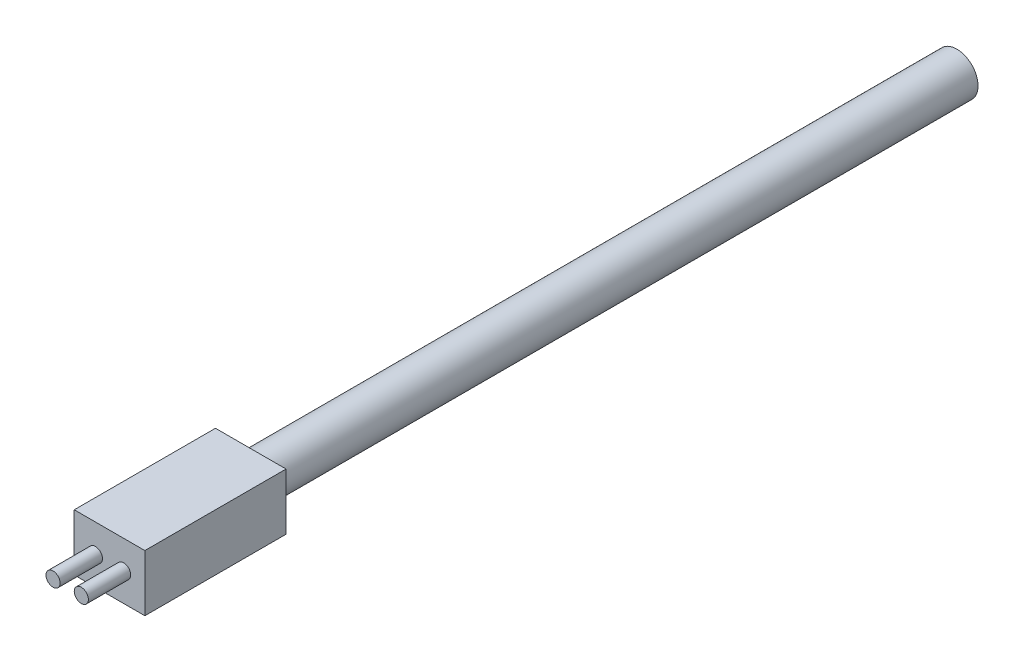
from build123d import *

# Parameters (mm, degrees)
SKETCH2_W           = 5
SKETCH2_H           = 10
BOSS_EXTRUDE1_DEPTH = 4
SKETCH4_R           = 0.5
BOSS_EXTRUDE2_DEPTH = 3
SKETCH5_R           = 1.5
BOSS_EXTRUDE3_DEPTH = 50


with BuildPart() as part:
    # Sketch2 → Boss-Extrude1 (new body)
    with BuildSketch(Plane(origin=(0, 0, 0), x_dir=(1, 0, 0), z_dir=(0, 1, 0))):
        Rectangle(SKETCH2_W, SKETCH2_H)
    extrude(amount=BOSS_EXTRUDE1_DEPTH)

    # Sketch4 → Boss-Extrude2 (add)
    with BuildSketch(Plane.XY.offset(5)):
        with Locations(Location((-1, 2, 0), (0, 0, 180))):
            Circle(SKETCH4_R)
        with Locations(Location((1, 2, 0), (0, 0, 180))):
            Circle(SKETCH4_R)
    extrude(amount=BOSS_EXTRUDE2_DEPTH)

    # Sketch5 → Boss-Extrude3 (add)
    with BuildSketch(Plane(origin=(0, 0, -5), x_dir=(-1, 0, 0), z_dir=(0, 0, -1))):
        with Locations((0, 2)):
            Circle(SKETCH5_R)
    extrude(amount=BOSS_EXTRUDE3_DEPTH)


solid = part.part
